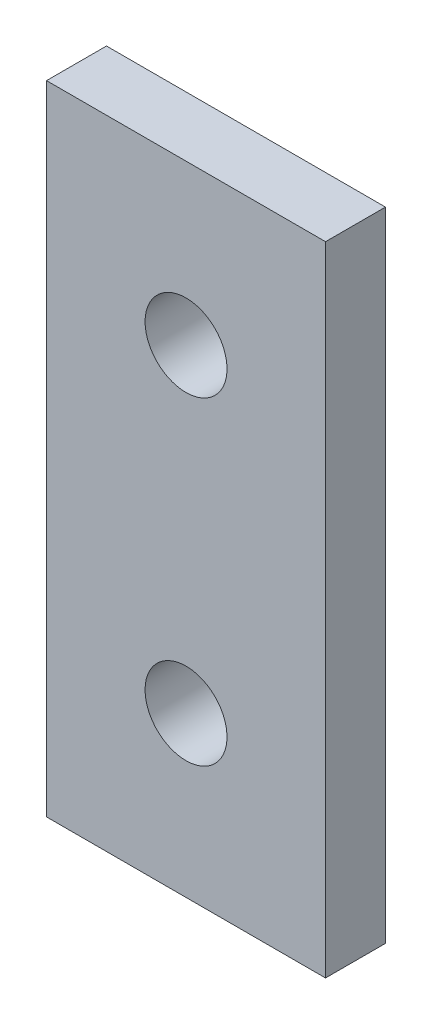
from build123d import *

# Parameters (mm, degrees)
SKETCH1_W           = 22.225
SKETCH1_H           = 50.8
SKETCH1_R           = 3.2639
BOSS_EXTRUDE1_DEPTH = 4.7752


with BuildPart() as part:
    # Sketch1 → Boss-Extrude1 (new body)
    with BuildSketch(Plane.XY.offset(4.7752)):
        with Locations((0, 25.4)):
            Rectangle(SKETCH1_W, SKETCH1_H)
        with Locations(Location((0, 38.1, 0), (0, 0, 180))):
            Circle(SKETCH1_R, mode=Mode.SUBTRACT)
        with Locations(Location((0, 12.7, 0), (0, 0, 180))):
            Circle(SKETCH1_R, mode=Mode.SUBTRACT)
    extrude(amount=-BOSS_EXTRUDE1_DEPTH)


solid = part.part
